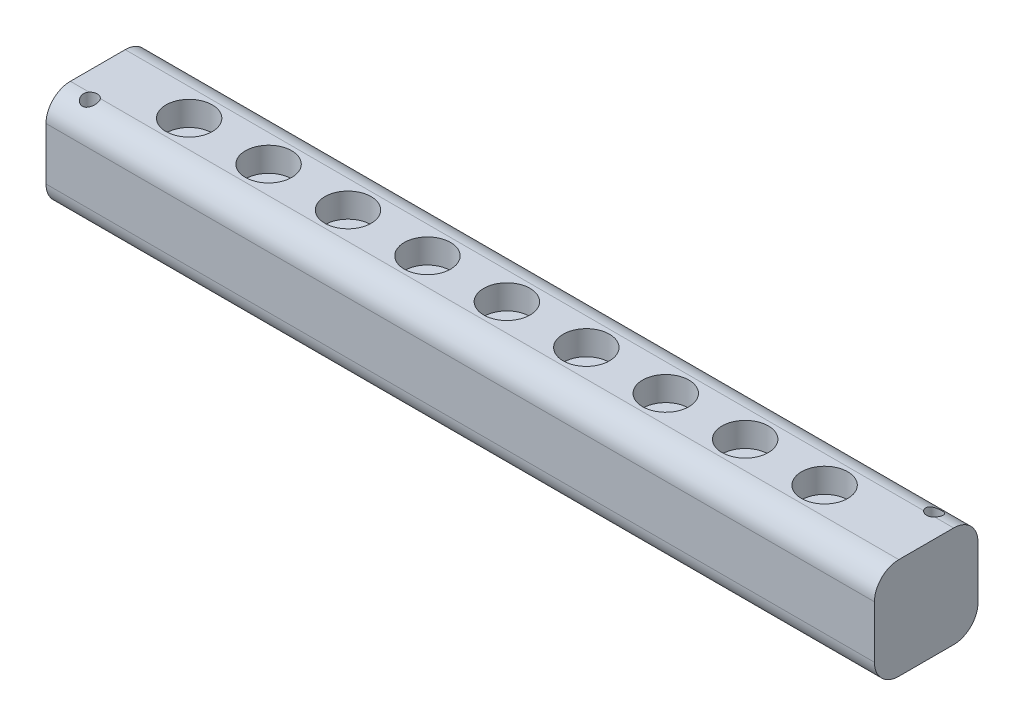
from build123d import *

# Parameters (mm, degrees)
SKETCH1_W           = 340
SKETCH1_H           = 42.5
BOSS_EXTRUDE1_DEPTH = 41.5
SKETCH2_R           = 9.5
CUT_EXTRUDE1_DEPTH  = 10
SKETCH4_R           = 3.05
CUT_EXTRUDE3_DEPTH  = 301.787476707
CUT_EXTRUDE4_DEPTH  = 344.473796902


with BuildPart() as part:
    # Sketch1 → Boss-Extrude1 (new body)
    with BuildSketch(Plane(origin=(0, 0, 0), x_dir=(1, 0, 0), z_dir=(0, 1, 0))):
        with Locations((126.814516129, -4.284274194)):
            Rectangle(SKETCH1_W, SKETCH1_H)
    extrude(amount=BOSS_EXTRUDE1_DEPTH)

    # Sketch2 → Cut-Extrude1 (cut)
    with BuildSketch(Plane(origin=(0, 41.5, 0), x_dir=(1, 0, 0), z_dir=(0, 1, 0))):
        with Locations(Location((-5.685483871, -4.284274194, 0), (0, 0, 270))):
            Circle(SKETCH2_R)
        with Locations(Location((26.914516129, -4.284274194, 0), (0, 0, 270))):
            Circle(SKETCH2_R)
        with Locations(Location((59.514516129, -4.284274194, 0), (0, 0, 270))):
            Circle(SKETCH2_R)
        with Locations(Location((92.114516129, -4.284274194, 0), (0, 0, 270))):
            Circle(SKETCH2_R)
        with Locations(Location((124.714516129, -4.284274194, 0), (0, 0, 270))):
            Circle(SKETCH2_R)
        with Locations(Location((157.314516129, -4.284274194, 0), (0, 0, 270))):
            Circle(SKETCH2_R)
        with Locations(Location((189.914516129, -4.284274194, 0), (0, 0, 270))):
            Circle(SKETCH2_R)
        with Locations(Location((222.514516129, -4.284274194, 0), (0, 0, 270))):
            Circle(SKETCH2_R)
        with Locations(Location((255.114516129, -4.284274194, 0), (0, 0, 270))):
            Circle(SKETCH2_R)
    extrude(amount=-CUT_EXTRUDE1_DEPTH, mode=Mode.SUBTRACT)

    # Sketch4 → Cut-Extrude3 (cut, through all)
    with BuildSketch(Plane(origin=(0, 41.5, 0), x_dir=(1, 0, 0), z_dir=(0, 1, 0))):
        with Locations(Location((286.814516129, 8.965725806, 0), (0, 0, 90))):
            Circle(SKETCH4_R)
        with Locations(Location((-33.185483871, -17.534274194, 0), (0, 0, 90))):
            Circle(SKETCH4_R)
    extrude(amount=-CUT_EXTRUDE3_DEPTH, mode=Mode.SUBTRACT)

    # Sketch3 → Cut-Extrude4 (cut, through all)
    with BuildSketch(Plane.ZY.offset(43.185483871)):
        with BuildLine():
            Line((-6.965725806, 41.5), (-16.965725806, 41.5))
            Line((-16.965725806, 41.5), (-16.965725806, 31.5))
            ThreePointArc((-16.965725806, 31.5), (-14.036793618, 38.571067812), (-6.965725806, 41.5))
        make_face()
        with BuildLine():
            ThreePointArc((-6.965725806, 0), (-14.036793618, 2.928932188), (-16.965725806, 10))
            Line((-16.965725806, 10), (-16.965725806, 0))
            Line((-16.965725806, 0), (-6.965725806, 0))
        make_face()
        with BuildLine():
            Line((25.534274194, 0), (25.534274194, 10))
            ThreePointArc((25.534274194, 10), (22.605342005, 2.928932188), (15.534274194, 0))
            Line((15.534274194, 0), (25.534274194, 0))
        make_face()
        with BuildLine():
            Line((25.534274194, 41.5), (15.534274194, 41.5))
            ThreePointArc((15.534274194, 41.5), (22.605342005, 38.571067812), (25.534274194, 31.5))
            Line((25.534274194, 31.5), (25.534274194, 41.5))
        make_face()
    extrude(amount=-CUT_EXTRUDE4_DEPTH, mode=Mode.SUBTRACT)


solid = part.part
